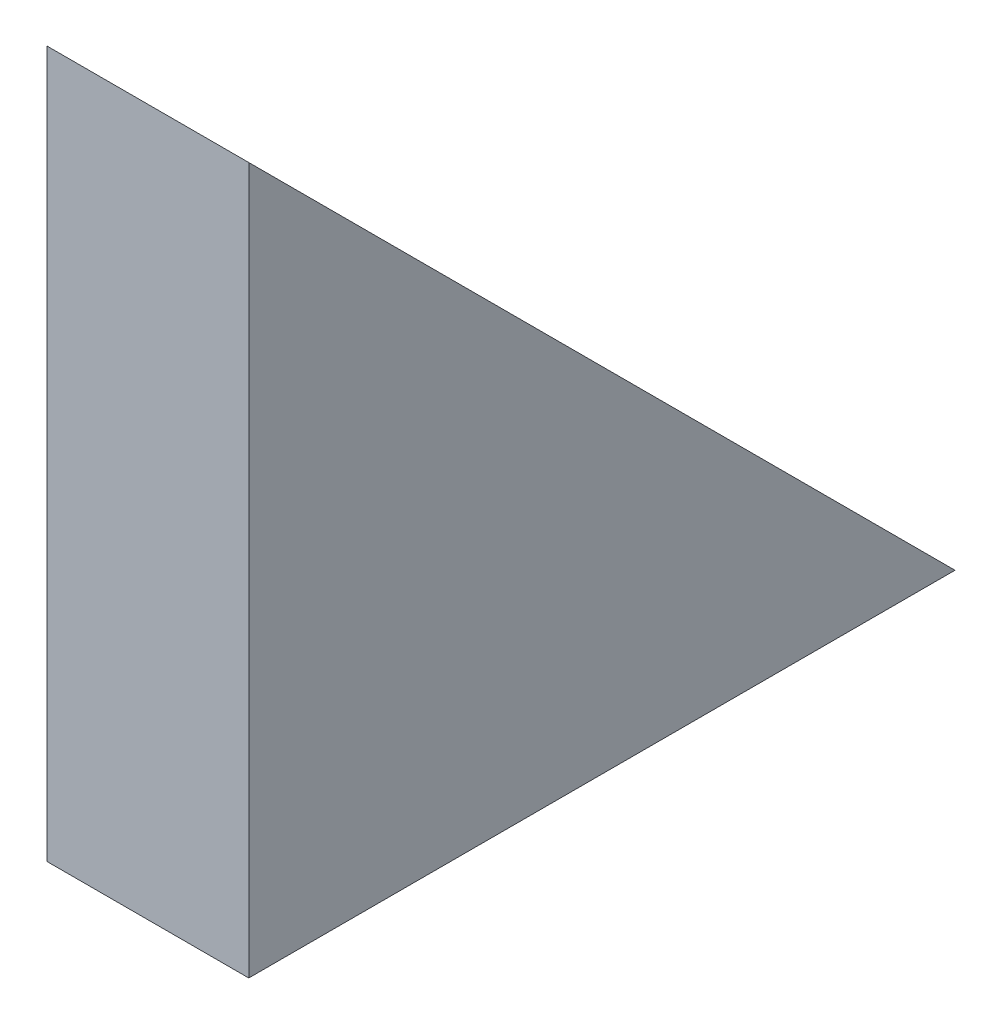
from build123d import *

# Parameters (mm, degrees)
BOSS_EXTRUDE1_DEPTH = 10


with BuildPart() as part:
    # Sketch1 → Boss-Extrude1 (new body)
    with BuildSketch(Plane(origin=(0, 0, 0), x_dir=(0, 0, -1), z_dir=(1, 0, 0))):
        Polygon((0, 0), (35, 0), (0, 35), align=None)
    extrude(amount=BOSS_EXTRUDE1_DEPTH)


solid = part.part
